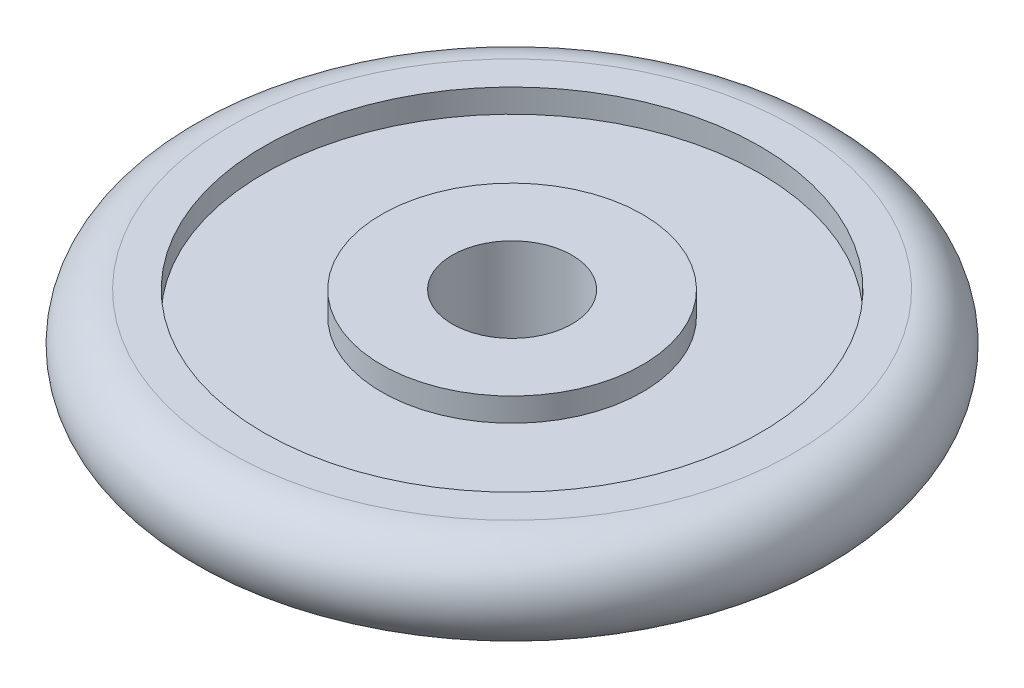
from build123d import *


with BuildPart() as part:
    # Croquis1 → Revolución1 (revolve)
    with BuildSketch(Plane.XY, mode=Mode.PRIVATE) as revoluci_n1_sk:
        with BuildLine():
            Line((12.7, -10), (12.7, 10))
            Line((12.7, 10), (27.7, 10))
            Line((27.7, 10), (27.7, 5))
            Line((27.7, 5), (52.7, 5))
            Line((52.7, 5), (52.7, 10))
            Line((52.7, 10), (60, 10))
            ThreePointArc((60, 10), (70, 0), (60, -10))
            Line((60, -10), (52.7, -10))
            Line((52.7, -10), (52.7, -5))
            Line((52.7, -5), (27.7, -5))
            Line((27.7, -5), (27.7, -10))
            Line((27.7, -10), (12.7, -10))
        make_face()
    revolve(revoluci_n1_sk.sketch.rotate(Axis((0, 0, 0), (0, 1, 0)), 90), axis=Axis((0, 0, 0), (0, 1, 0)))


solid = part.part
